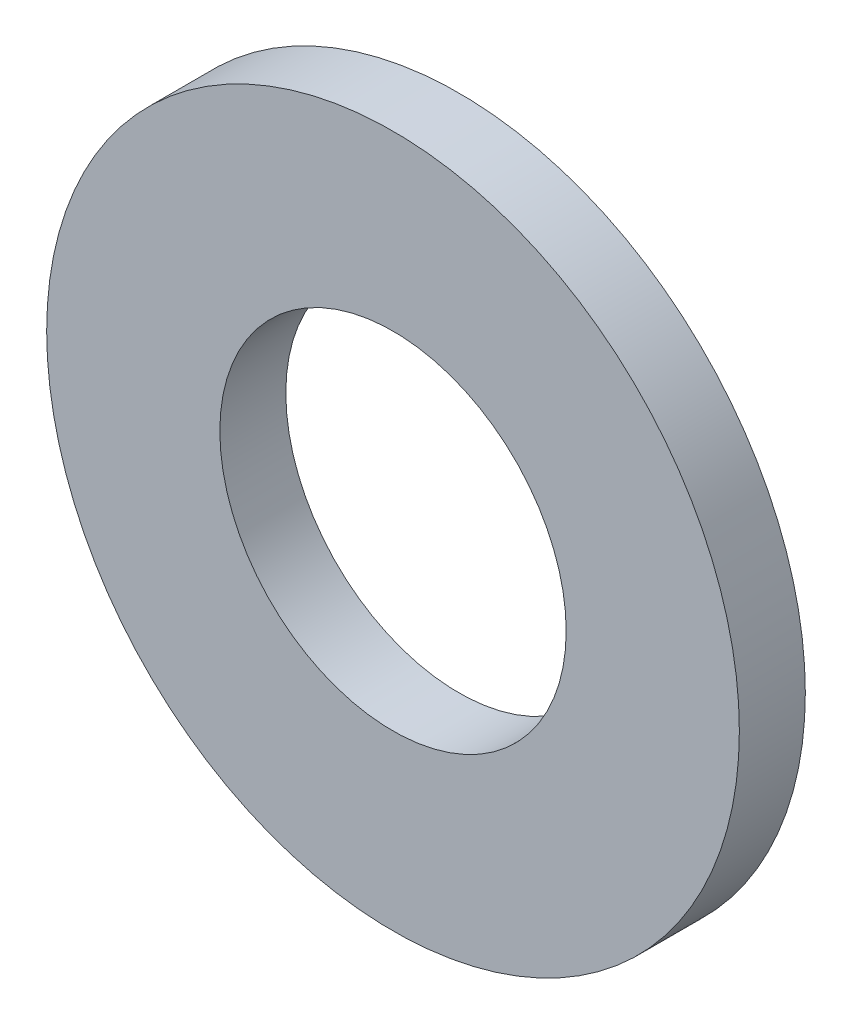
from build123d import *

# Parameters (mm, degrees)
SKETCH_1_R      = 10.5
SKETCH_1_R_2    = 5.25
EXTRUDE_1_DEPTH = 2


with BuildPart() as part:
    # Эскиз1 → Вытянуть1 (new body)
    with BuildSketch(Plane.XY):
        Circle(SKETCH_1_R)
        Circle(SKETCH_1_R_2, mode=Mode.SUBTRACT)
    extrude(amount=EXTRUDE_1_DEPTH)


solid = part.part
